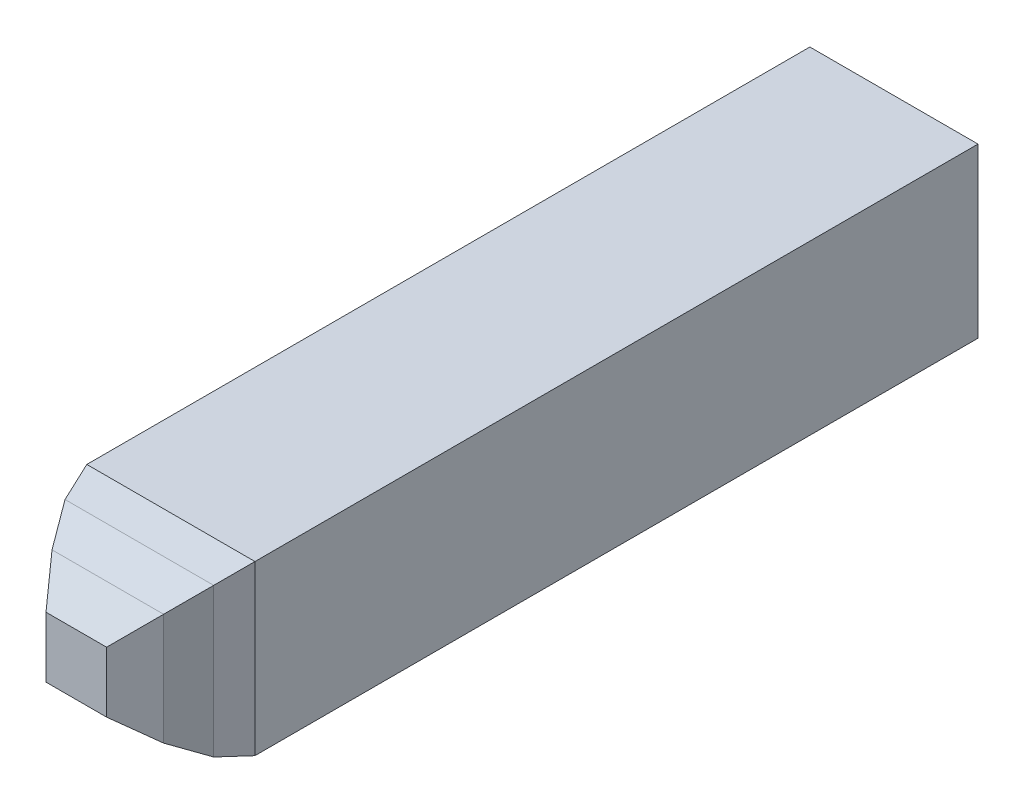
from build123d import *

# Parameters (mm, degrees)
SKETCH1_W           = 101.6
SKETCH1_H           = 101.6
BOSS_EXTRUDE1_DEPTH = 436.88


with BuildPart() as part:
    # Sketch1 → Boss-Extrude1 (new body)
    with BuildSketch(Plane.XY):
        Rectangle(SKETCH1_W, SKETCH1_H)
    extrude(amount=BOSS_EXTRUDE1_DEPTH)

    # Sketch5 → Loft2 section 0
    with BuildSketch(Plane.XY.offset(436.88)):
        with BuildLine():
            Line((50.8, -50.8), (50.8, 50.8))
            Line((50.8, 50.8), (-50.8, 50.8))
            Line((-50.8, 50.8), (-50.8, -50.8))
            Line((-50.8, -50.8), (50.8, -50.8))
        make_face()
    # Sketch3 → Loft2 section 1
    with BuildSketch(Plane.XY.offset(455.93)):
        with BuildLine():
            Line((-44.913226277, -44.913226277), (44.913226277, -44.913226277))
            Line((44.913226277, -44.913226277), (44.913226277, 44.913226277))
            Line((44.913226277, 44.913226277), (-44.913226277, 44.913226277))
            Line((-44.913226277, 44.913226277), (-44.913226277, -44.913226277))
        make_face()
    loft()

    # Sketch3<6> → Loft3 section 0
    with BuildSketch(Plane.XY.offset(455.93)):
        with BuildLine():
            Line((-44.913226277, -44.913226277), (44.913226277, -44.913226277))
            Line((44.913226277, -44.913226277), (44.913226277, 44.913226277))
            Line((44.913226277, 44.913226277), (-44.913226277, 44.913226277))
            Line((-44.913226277, 44.913226277), (-44.913226277, -44.913226277))
        make_face()
    # Sketch6 → Loft3 section 1
    with BuildSketch(Plane.XY.offset(474.98)):
        with BuildLine():
            Line((-33.715917201, -33.715917221), (33.715917201, -33.715917221))
            Line((33.715917201, -33.715917221), (33.715917201, 33.715917221))
            Line((33.715917201, 33.715917221), (-33.715917201, 33.715917221))
            Line((-33.715917201, 33.715917221), (-33.715917201, -33.715917221))
        make_face()
    loft()

    # Sketch6<4> → Loft4 section 0
    with BuildSketch(Plane.XY.offset(474.98)):
        with BuildLine():
            Line((-33.715917201, -33.715917221), (33.715917201, -33.715917221))
            Line((33.715917201, -33.715917221), (33.715917201, 33.715917221))
            Line((33.715917201, 33.715917221), (-33.715917201, 33.715917221))
            Line((-33.715917201, 33.715917221), (-33.715917201, -33.715917221))
        make_face()
    # Sketch7 → Loft4 section 1
    with BuildSketch(Plane.XY.offset(494.03)):
        with BuildLine():
            Line((-18.304143478, -18.304143458), (18.304143478, -18.304143458))
            Line((18.304143478, -18.304143458), (18.304143478, 18.304143458))
            Line((18.304143478, 18.304143458), (-18.304143478, 18.304143458))
            Line((-18.304143478, 18.304143458), (-18.304143478, -18.304143458))
        make_face()
    loft()


solid = part.part
